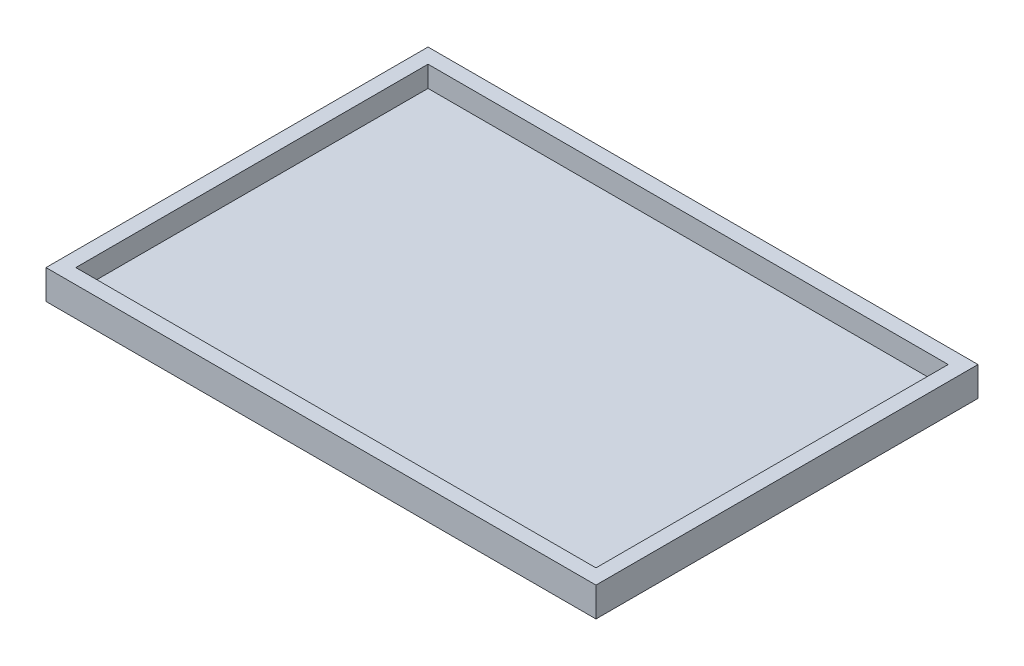
from build123d import *

# Parameters (mm, degrees)
SKETCH1_W           = 131
SKETCH1_H           = 91
BOSS_EXTRUDE1_DEPTH = 7
SKETCH2_W           = 123.9
SKETCH2_H           = 83.9
CUT_EXTRUDE1_DEPTH  = 5


with BuildPart() as part:
    # Sketch1 → Boss-Extrude1 (new body)
    with BuildSketch(Plane(origin=(0, 0, 0), x_dir=(1, 0, 0), z_dir=(0, 1, 0))):
        Rectangle(SKETCH1_W, SKETCH1_H)
    extrude(amount=BOSS_EXTRUDE1_DEPTH)

    # Sketch2 → Cut-Extrude1 (cut)
    with BuildSketch(Plane(origin=(0, 7, 0), x_dir=(1, 0, 0), z_dir=(0, 1, 0))):
        Rectangle(SKETCH2_W, SKETCH2_H)
    extrude(amount=-CUT_EXTRUDE1_DEPTH, mode=Mode.SUBTRACT)


solid = part.part
